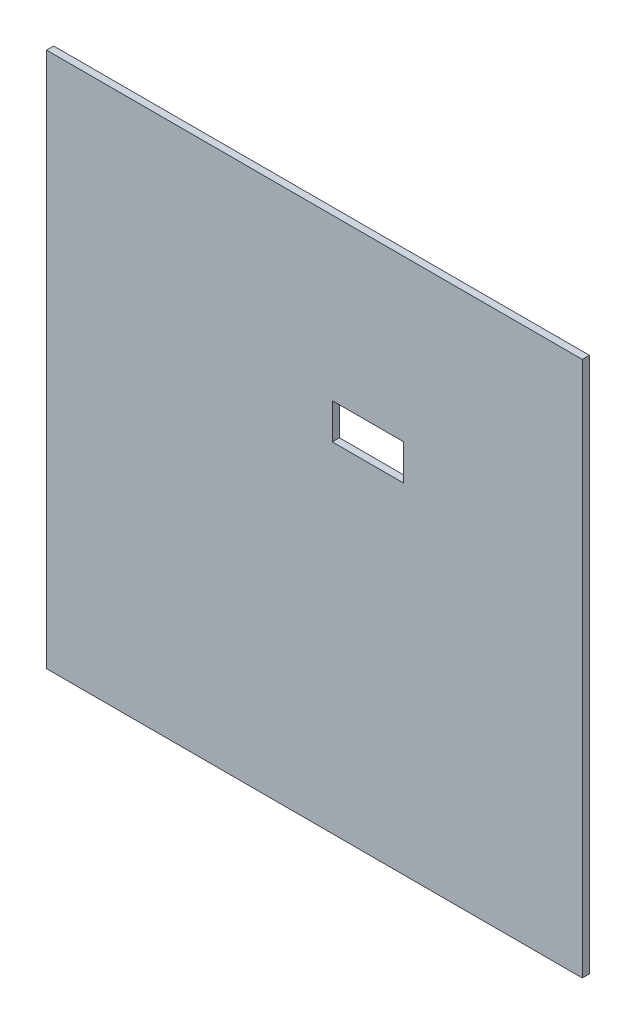
from build123d import *

# Parameters (mm, degrees)
SKETCH8_W           = 15000
SKETCH8_H           = 15000
BOSS_EXTRUDE1_DEPTH = 200
SKETCH9_W           = 2000
SKETCH9_H           = 1000
CUT_EXTRUDE3_DEPTH  = 14144.54976659


with BuildPart() as part:
    # Sketch8 → Boss-Extrude1 (new body)
    with BuildSketch(Plane.XY):
        with Locations((2500, -2500)):
            Rectangle(SKETCH8_W, SKETCH8_H)
    extrude(amount=BOSS_EXTRUDE1_DEPTH)

    # Sketch9 → Cut-Extrude3 (cut, through all)
    with BuildSketch(Plane.XY.offset(200)):
        with Locations((4000, 0)):
            Rectangle(SKETCH9_W, SKETCH9_H)
    extrude(amount=-CUT_EXTRUDE3_DEPTH, mode=Mode.SUBTRACT)


solid = part.part
